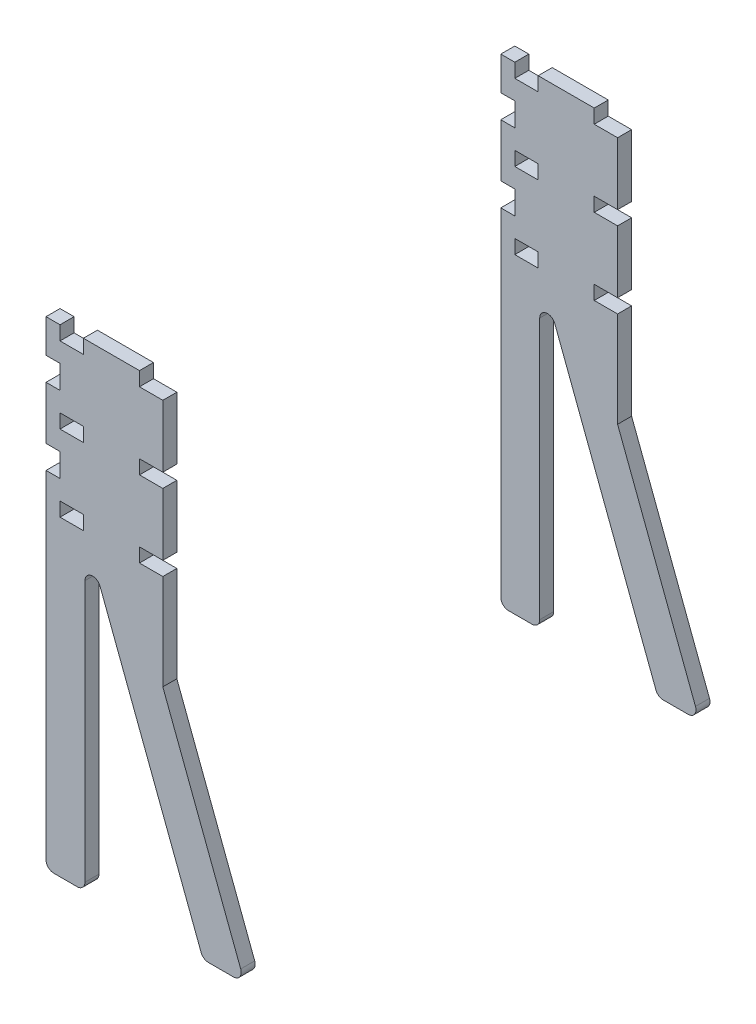
from build123d import *

# Parameters (mm, degrees)
BOSS_EXTRU_1_DEPTH         = 18
R_P_TITION_LIN_AIRE1_COUNT = 2
R_P_TITION_LIN_AIRE1_PITCH = 584
ESQUISSE2_W                = 18
ESQUISSE2_H                = 30
ESQUISSE2_W_2              = 30
ESQUISSE2_H_2              = 18
ENL_V_MAT_EXTRU_1_DEPTH    = 896.670249126


with BuildPart() as part:
    # Esquisse1 → Boss.-Extru.1 (new body)
    with BuildSketch(Plane.XY):
        with BuildLine():
            Line((10, 0), (40, 0))
            ThreePointArc((40, 0), (47.071067812, 2.928932188), (50, 10))
            Line((50, 10), (50, 345.419131188))
            ThreePointArc((50, 345.419131188), (58.19785334, 355.255404233), (69.350453483, 348.964412512))
            Line((69.350453483, 348.964412512), (199.215087638, 6.454718676))
            ThreePointArc((199.215087638, 6.454718676), (202.884555874, 1.770394504), (208.565541121, 0))
            Line((208.565541121, 0), (240.649546517, 0))
            ThreePointArc((240.649546517, 0), (248.879152013, 4.319014753), (250, 13.545281324))
            Line((250, 13.545281324), (150, 277.288906417))
            Line((150, 277.288906417), (150, 614))
            Line((150, 614), (0, 614))
            Line((0, 614), (0, 10))
            ThreePointArc((0, 10), (2.928932188, 2.928932188), (10, 0))
        make_face()
    extrude(amount=BOSS_EXTRU_1_DEPTH)


with BuildPart() as r_p_tition_lin_aire1_1:
    # Répétition linéaire1: pattern copy
    add(part.part.moved(Location(Vector(0, 0, -1) * (1 * R_P_TITION_LIN_AIRE1_PITCH))))


with BuildPart() as enl_v_mat_extru_1_tool:
    # Esquisse2 → Enlèv. mat.-Extru.1 (new, through all)
    with BuildSketch(Plane.XY.offset(18)):
        with Locations((9, 556)):
            Rectangle(ESQUISSE2_W, ESQUISSE2_H)
        with Locations((9, 458)):
            Rectangle(ESQUISSE2_W, ESQUISSE2_H)
        with Locations((33, 605)):
            Rectangle(ESQUISSE2_W_2, ESQUISSE2_H_2)
        with Locations((135, 605)):
            Rectangle(ESQUISSE2_W_2, ESQUISSE2_H_2)
        with Locations((33, 507)):
            Rectangle(ESQUISSE2_W_2, ESQUISSE2_H_2)
        with Locations((135, 507)):
            Rectangle(ESQUISSE2_W_2, ESQUISSE2_H_2)
        with Locations((135, 409)):
            Rectangle(ESQUISSE2_W_2, ESQUISSE2_H_2)
        with Locations((33, 409)):
            Rectangle(ESQUISSE2_W_2, ESQUISSE2_H_2)
    extrude(amount=-ENL_V_MAT_EXTRU_1_DEPTH)


with BuildPart() as part_1:
    add(part.part)

    # Enlèv. mat.-Extru.1: cut by enl_v_mat_extru_1_tool
    add(enl_v_mat_extru_1_tool.part, mode=Mode.SUBTRACT)


with BuildPart() as r_p_tition_lin_aire1_1_1:
    add(r_p_tition_lin_aire1_1.part)

    # Enlèv. mat.-Extru.1: cut by enl_v_mat_extru_1_tool
    add(enl_v_mat_extru_1_tool.part, mode=Mode.SUBTRACT)


solid = Compound([part_1.part, r_p_tition_lin_aire1_1_1.part])
